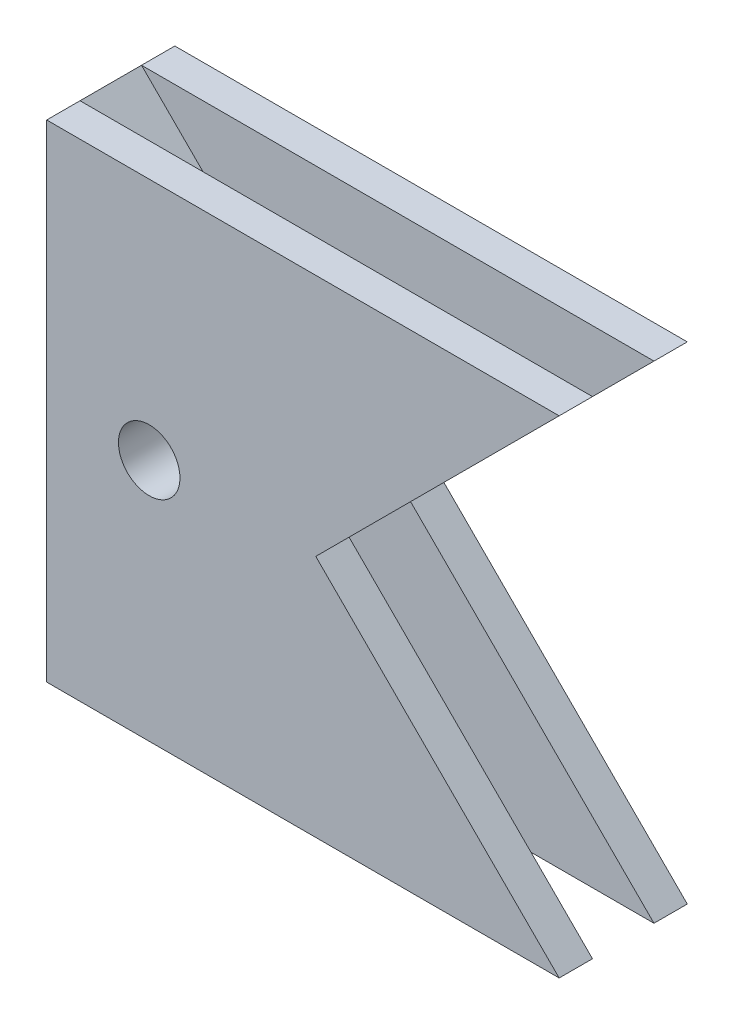
from build123d import *

# Parameters (mm, degrees)
BOSS_EXTRUDE1_START = -12.5
BOSS_EXTRUDE1_DEPTH = 6.5
SKETCH1_3_R         = 6
BOSS_EXTRUDE2_DEPTH = 12.5


with BuildPart() as part:
    # Sketch1 → Boss-Extrude1 (new body)
    with BuildSketch(Plane.XY.offset(BOSS_EXTRUDE1_START)):
        with BuildLine():
            Line((52.5, 47.5), (100, 95))
            Line((100, 95), (0, 95))
            Line((0, 95), (43.964466094, 51.035533906))
            ThreePointArc((43.964466094, 51.035533906), (45.428932188, 47.5), (43.964466094, 43.964466094))
            Line((43.964466094, 43.964466094), (0, 0))
            Line((0, 0), (100, 0))
            Line((100, 0), (52.5, 47.5))
        make_face()
    boss_extrude1 = extrude(amount=BOSS_EXTRUDE1_DEPTH)

    # Sketch1<3> → Boss-Extrude2 (add, symmetric)
    with BuildSketch(Plane.XY):
        with BuildLine():
            Line((43.964466094, 51.035533906), (0, 95))
            Line((0, 95), (0, 0))
            Line((0, 0), (43.964466094, 43.964466094))
            ThreePointArc((43.964466094, 43.964466094), (45.428932188, 47.5), (43.964466094, 51.035533906))
        make_face()
        with Locations((20, 47.5)):
            Circle(SKETCH1_3_R, mode=Mode.SUBTRACT)
    extrude(amount=BOSS_EXTRUDE2_DEPTH, both=True)

    # Mirror2: Boss-Extrude1 across plane
    add(boss_extrude1.mirror(Plane.XY))


solid = part.part
